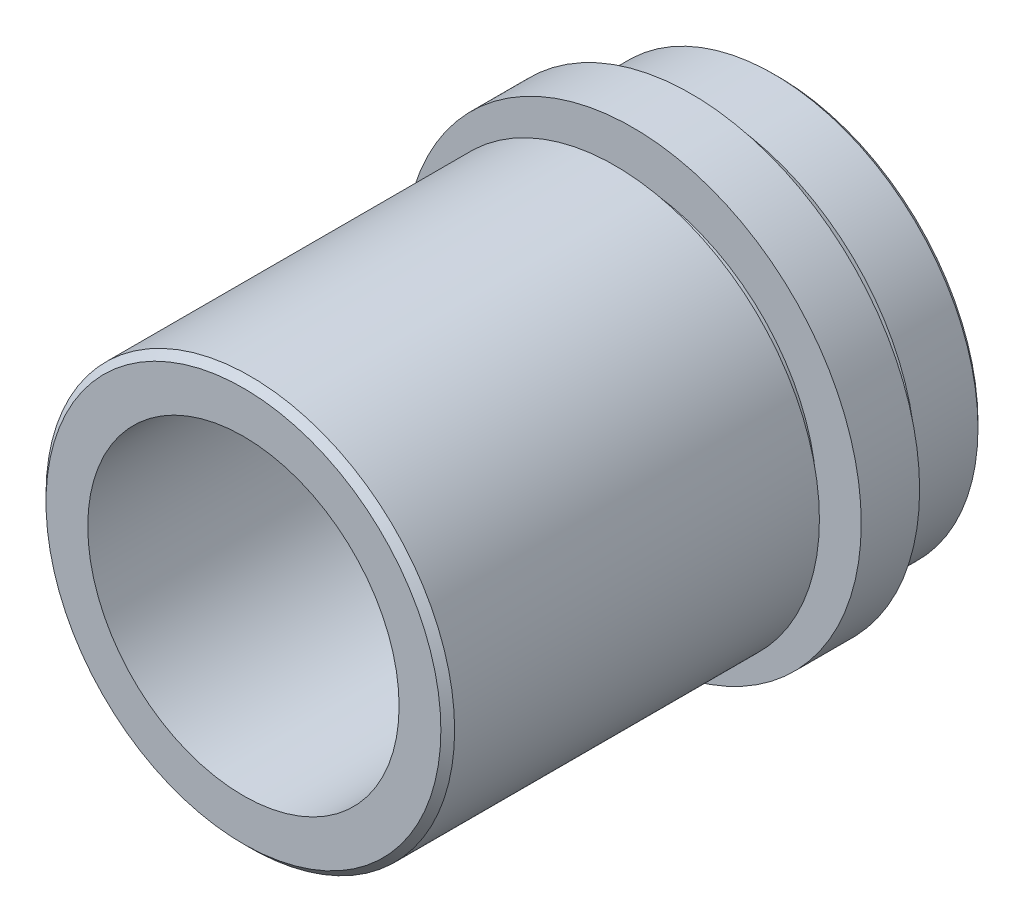
from build123d import *

# Parameters (mm, degrees)
SZKIC1_W = 6
SZKIC1_H = 23.5
SZKIC2_W = 40
SZKIC2_H = 21
SZKIC4_W = 1.8
SZKIC4_H = 2.1
SZKIC5_W = 9
SZKIC5_H = 21
SZKIC8_W = 2.1
SZKIC8_H = 2.1


with BuildPart() as part:
    # Szkic1 → Obrót1 (revolve)
    with BuildSketch(Plane(origin=(0, 0, 0), x_dir=(0, 0, -1), z_dir=(1, 0, 0))):
        with Locations((-12, 11.75)):
            Rectangle(SZKIC1_W, SZKIC1_H)
    revolve(axis=Axis((0, 0, 9), (0, 0, 1)))

    # Szkic2 → Obrót2 (revolve)
    with BuildSketch(Plane(origin=(0, 0, 0), x_dir=(0, 0, -1), z_dir=(1, 0, 0))):
        with Locations((-35, 10.5)):
            Rectangle(SZKIC2_W, SZKIC2_H)
    revolve(axis=Axis((0, 0, 15), (0, 0, 1)))

    # Szkic3 → Wycięcie-obrót1 (revolve, cut)
    with BuildSketch(Plane(origin=(0, 0, 0), x_dir=(0, 0, -1), z_dir=(1, 0, 0))):
        Polygon((-55, 20.292893219), (-54.292893219, 21), (-55, 21), align=None)
    revolve(axis=Axis((0, 0, 15), (0, 0, 1)), mode=Mode.SUBTRACT)

    # Szkic4 → Wycięcie-obrót2 (revolve, cut)
    with BuildSketch(Plane(origin=(0, 0, 0), x_dir=(0, 0, -1), z_dir=(1, 0, 0))):
        with Locations((-15.9, 19.95)):
            Rectangle(SZKIC4_W, SZKIC4_H)
    revolve(axis=Axis((0, 0, 15), (0, 0, 1)), mode=Mode.SUBTRACT)

    # Szkic5 → Obrót3 (revolve)
    with BuildSketch(Plane(origin=(0, 0, 0), x_dir=(0, 0, -1), z_dir=(1, 0, 0))):
        with Locations((-4.5, 10.5)):
            Rectangle(SZKIC5_W, SZKIC5_H)
    revolve(axis=Axis((0, 0, 0), (0, 0, 1)))

    # Szkic6 → Wycięcie-obrót3 (revolve, cut)
    with BuildSketch(Plane(origin=(0, 0, 0), x_dir=(0, 0, -1), z_dir=(1, 0, 0))):
        Polygon((-55, 0), (-55, 16), (-1, 16), (0, 17), (0, 0), align=None)
    revolve(axis=Axis((0, 0, 0), (0, 0, 1)), mode=Mode.SUBTRACT)

    # Szkic7 → Wycięcie-obrót4 (revolve, cut)
    with BuildSketch(Plane(origin=(0, 0, 0), x_dir=(0, 0, -1), z_dir=(1, 0, 0))):
        Polygon((-0.5, 21), (0, 20.5), (0, 21), align=None)
    revolve(axis=Axis((0, 0, 0), (0, 0, 1)), mode=Mode.SUBTRACT)

    # Szkic8 → Wycięcie-obrót5 (revolve, cut)
    with BuildSketch(Plane(origin=(0, 0, 0), x_dir=(0, 0, -1), z_dir=(1, 0, 0))):
        with Locations((-7.95, 19.95)):
            Rectangle(SZKIC8_W, SZKIC8_H)
    revolve(axis=Axis((0, 0, 0), (0, 0, 1)), mode=Mode.SUBTRACT)


solid = part.part
